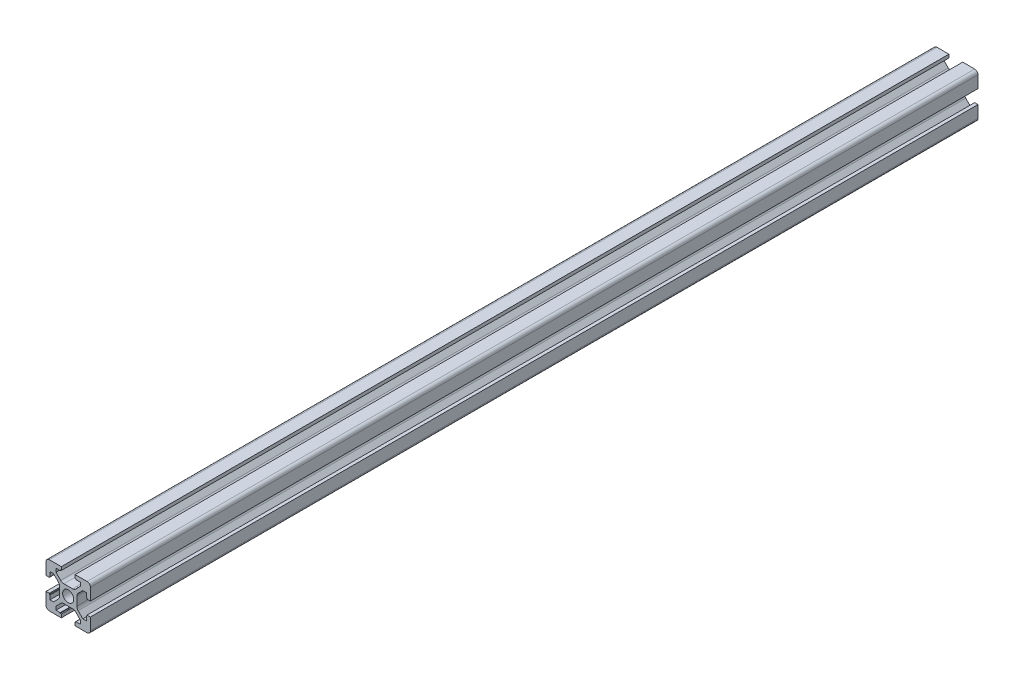
from build123d import *

# Parameters (mm, degrees)
SKETCH1_R           = 2.5
BOSS_EXTRUDE1_DEPTH = 400


with BuildPart() as part:
    # Sketch1 → Boss-Extrude1 (new body)
    with BuildSketch(Plane.XY):
        with BuildLine():
            Line((1.971572875, 3.9), (-1.971572875, 3.9))
            ThreePointArc((-1.971572875, 3.9), (-2.73693974, 4.052240935), (-3.385786438, 4.485786438))
            Line((-3.385786438, 4.485786438), (-5.5, 6.6))
            Line((-5.5, 6.6), (-5.5, 8.2))
            Line((-5.5, 8.2), (-3.6, 8.2))
            Line((-3.6, 8.2), (-3.6, 8.5))
            Line((-3.6, 8.5), (-3.1, 8.5))
            Line((-3.1, 8.5), (-3.1, 10))
            Line((-3.1, 10), (-8.5, 10))
            ThreePointArc((-8.5, 10), (-9.560660172, 9.560660172), (-10, 8.5))
            Line((-10, 8.5), (-10, 3.1))
            Line((-10, 3.1), (-8.5, 3.1))
            Line((-8.5, 3.1), (-8.5, 3.6))
            Line((-8.5, 3.6), (-8.2, 3.6))
            Line((-8.2, 3.6), (-8.2, 5.5))
            Line((-8.2, 5.5), (-6.6, 5.5))
            Line((-6.6, 5.5), (-4.485786438, 3.385786438))
            ThreePointArc((-4.485786438, 3.385786438), (-4.052240935, 2.73693974), (-3.9, 1.971572875))
            Line((-3.9, 1.971572875), (-3.9, -1.971572875))
            ThreePointArc((-3.9, -1.971572875), (-4.052240935, -2.73693974), (-4.485786438, -3.385786438))
            Line((-4.485786438, -3.385786438), (-6.6, -5.5))
            Line((-6.6, -5.5), (-8.2, -5.5))
            Line((-8.2, -5.5), (-8.2, -3.6))
            Line((-8.2, -3.6), (-8.5, -3.6))
            Line((-8.5, -3.6), (-8.5, -3.1))
            Line((-8.5, -3.1), (-10, -3.1))
            Line((-10, -3.1), (-10, -8.5))
            ThreePointArc((-10, -8.5), (-9.560660172, -9.560660172), (-8.5, -10))
            Line((-8.5, -10), (-3.1, -10))
            Line((-3.1, -10), (-3.1, -8.5))
            Line((-3.1, -8.5), (-3.6, -8.5))
            Line((-3.6, -8.5), (-3.6, -8.2))
            Line((-3.6, -8.2), (-5.5, -8.2))
            Line((-5.5, -8.2), (-5.5, -6.6))
            Line((-5.5, -6.6), (-3.385786438, -4.485786438))
            ThreePointArc((-3.385786438, -4.485786438), (-2.73693974, -4.052240935), (-1.971572875, -3.9))
            Line((-1.971572875, -3.9), (1.971572875, -3.9))
            ThreePointArc((1.971572875, -3.9), (2.73693974, -4.052240935), (3.385786438, -4.485786438))
            Line((3.385786438, -4.485786438), (5.5, -6.6))
            Line((5.5, -6.6), (5.5, -8.2))
            Line((5.5, -8.2), (3.6, -8.2))
            Line((3.6, -8.2), (3.6, -8.5))
            Line((3.6, -8.5), (3.1, -8.5))
            Line((3.1, -8.5), (3.1, -10))
            Line((3.1, -10), (8.5, -10))
            ThreePointArc((8.5, -10), (9.560660172, -9.560660172), (10, -8.5))
            Line((10, -8.5), (10, -3.1))
            Line((10, -3.1), (8.5, -3.1))
            Line((8.5, -3.1), (8.5, -3.6))
            Line((8.5, -3.6), (8.2, -3.6))
            Line((8.2, -3.6), (8.2, -5.5))
            Line((8.2, -5.5), (6.6, -5.5))
            Line((6.6, -5.5), (4.485786438, -3.385786438))
            ThreePointArc((4.485786438, -3.385786438), (4.052240935, -2.73693974), (3.9, -1.971572875))
            Line((3.9, -1.971572875), (3.9, 1.971572875))
            ThreePointArc((3.9, 1.971572875), (4.052240935, 2.73693974), (4.485786438, 3.385786438))
            Line((4.485786438, 3.385786438), (6.6, 5.5))
            Line((6.6, 5.5), (8.2, 5.5))
            Line((8.2, 5.5), (8.2, 3.6))
            Line((8.2, 3.6), (8.5, 3.6))
            Line((8.5, 3.6), (8.5, 3.1))
            Line((8.5, 3.1), (10, 3.1))
            Line((10, 3.1), (10, 8.5))
            ThreePointArc((10, 8.5), (9.560660172, 9.560660172), (8.5, 10))
            Line((8.5, 10), (3.1, 10))
            Line((3.1, 10), (3.1, 8.5))
            Line((3.1, 8.5), (3.6, 8.5))
            Line((3.6, 8.5), (3.6, 8.2))
            Line((3.6, 8.2), (5.5, 8.2))
            Line((5.5, 8.2), (5.5, 6.6))
            Line((5.5, 6.6), (3.385786438, 4.485786438))
            ThreePointArc((3.385786438, 4.485786438), (2.73693974, 4.052240935), (1.971572875, 3.9))
        make_face()
        Circle(SKETCH1_R, mode=Mode.SUBTRACT)
    extrude(amount=BOSS_EXTRUDE1_DEPTH)


solid = part.part
